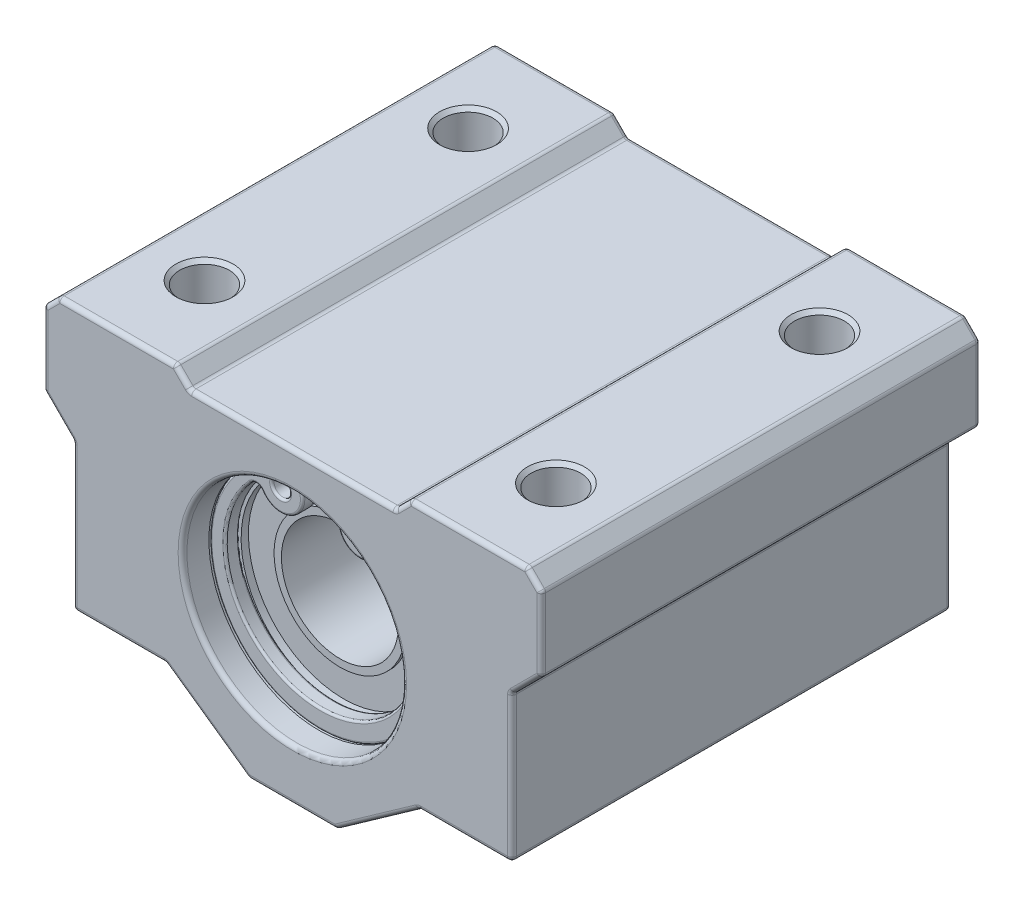
from build123d import *

# Parameters (mm, degrees)
SCHIZZO1_R                    = 7.5
ESTRUSIONE_ESTRUSIONE1_DEPTH  = 15
FORO_PER_VITE_M4_1_D          = 3.4
RIPETIZIONE_A_L1_COUNT        = 2
RIPETIZIONE_A_L1_PITCH        = 24
RIPETIZIONE_A_L1_COUNT_DIR2   = 2
RIPETIZIONE_A_L1_PITCH_DIR2   = 18
SMUSSO1_SIZE                  = 0.25
SMUSSO2_SIZE                  = 0.5
RACCORDO1_R                   = 0.3
TAGLIO_ESTRUSIONE2_DEPTH      = 26.199206396
TAGLIO_ESTRUSIONE2_DEPTH_BACK = 26.199206396
SCHIZZO8_R                    = 4
TAGLIO_ESTRUSIONE1_START      = 12.1
SCHIZZO7_R                    = 7.85
TAGLIO_ESTRUSIONE1_DEPTH      = 1.1
ESTRUSIONE_ESTRUSIONE2_START  = 12.1
SCHIZZO9_R                    = 0.6
ESTRUSIONE_ESTRUSIONE2_DEPTH  = 1
RIPETIZIONE_A_L2_COUNT        = 2
RIPETIZIONE_A_L2_PITCH        = 25.2
RACCORDO4_R                   = 0.15
RACCORDO5_R                   = 0.15


with BuildPart() as part:
    # Schizzo1 → Estrusione-Estrusione1 (new, symmetric)
    with BuildSketch(Plane.XY):
        Polygon((3, -11), (8.666666667, -7), (15, -7), (15, 3), (17, 5), (17, 10), (16, 11), (8, 11), (7, 10), (-7, 10), (-8, 11), (-16, 11), (-17, 10), (-17, 5), (-15, 3), (-15, -7), (-8.666666667, -7), (-3, -11), align=None)
        Circle(SCHIZZO1_R, mode=Mode.SUBTRACT)
    extrude(amount=ESTRUSIONE_ESTRUSIONE1_DEPTH, both=True)

    # Foro per Vite M4-1 (through all)
    with Locations(Plane(origin=(0, 11, 0), x_dir=(1, 0, 0), z_dir=(0, 1, 0))):
        with Locations((-12, 9)):
            foro_per_vite_m4_1 = Hole(FORO_PER_VITE_M4_1_D / 2)

    # Ripetizione a L1: Foro per Vite M4-1 2 × 2
    with Locations(*[(i * RIPETIZIONE_A_L1_PITCH, 0, j * RIPETIZIONE_A_L1_PITCH_DIR2) for i in range(RIPETIZIONE_A_L1_COUNT) for j in range(RIPETIZIONE_A_L1_COUNT_DIR2) if (i, j) != (0, 0)]):
        add(foro_per_vite_m4_1, mode=Mode.SUBTRACT)

    # Smusso1
    smusso1_edges = [part.edges().sort_by_distance(p)[0] for p in [
        (-10.3, 11, -9),
        (-10.3, 11, 9),
        (13.7, 11, -9),
        (13.7, 11, 9),
    ]]
    chamfer(smusso1_edges, length=SMUSSO1_SIZE)

    # Smusso2
    smusso2_edges = [part.edges().sort_by_distance(p)[0] for p in [
        (-10.3, -7, -9),
        (-10.3, -7, 9),
        (13.7, -7, -9),
        (13.7, -7, 9),
    ]]
    chamfer(smusso2_edges, length=SMUSSO2_SIZE)

    # Schizzo6 → Rivoluzione1 (revolve)
    with BuildSketch(Plane(origin=(0, 0, 0), x_dir=(0, 0, -1), z_dir=(1, 0, 0)), mode=Mode.PRIVATE) as rivoluzione1_sk:
        Polygon((-12, 6.5), (-11.5, 6.5), (-11.5, 4.5), (-11.75, 4.5), (-11.75, 0), (11.75, 0), (11.75, 4.5), (11.5, 4.5), (11.5, 6.5), (12, 6.5), (12, 7.5), (-12, 7.5), align=None)
    revolve(rivoluzione1_sk.sketch.rotate(Axis((0, 0, 20), (0, 0, -1)), 180), axis=Axis((0, 0, 20), (0, 0, -1)))

    # Raccordo1
    raccordo1_edges = [part.edges().sort_by_distance(p)[0] for p in [
        (11.833333333, -7, 15),
        (15, -2, 15),
        (-5.833333333, -9, -15),
        (16, 4, 15),
        (-11.833333333, -7, -15),
        (-15, -2, -15),
        (-16, 4, -15),
        (-17, 7.5, -15),
        (-16.5, 10.5, -15),
        (-12, 11, -15),
        (-7.5, 10.5, -15),
        (0, 10, -15),
        (17, 7.5, 15),
        (7.5, 10.5, -15),
        (12, 11, -15),
        (16.5, 10.5, -15),
        (17, 7.5, -15),
        (16, 4, -15),
        (15, -2, -15),
        (11.833333333, -7, -15),
        (16.5, 10.5, 15),
        (5.833333333, -9, -15),
        (0, -11, -15),
        (12, 11, 15),
        (7.5, 10.5, 15),
        (-3, -11, 0),
        (-8.666666667, -7, 0),
        (-15, -7, 0),
        (-15, 3, 0),
        (-17, 5, 0),
        (-17, 10, 0),
        (-16, 11, 0),
        (-8, 11, 0),
        (-7, 10, 0),
        (7, 10, 0),
        (8, 11, 0),
        (16, 11, 0),
        (17, 10, 0),
        (17, 5, 0),
        (15, 3, 0),
        (15, -7, 0),
        (8.666666667, -7, 0),
        (3, -11, 0),
        (0, 10, 15),
        (-7.5, 10.5, 15),
        (-12, 11, 15),
        (0, -11, 15),
        (-16.5, 10.5, 15),
        (-7.5, 0, -15),
        (-17, 7.5, 15),
        (-7.5, 0, 15),
        (-16, 4, 15),
        (-15, -2, 15),
        (-11.833333333, -7, 15),
        (-5.833333333, -9, 15),
        (5.833333333, -9, 15),
    ]]
    fillet(raccordo1_edges, radius=RACCORDO1_R)

    # Schizzo8 → Taglio-Estrusione2 (cut, two sides: drawn at the far end of the back side and taken through both)
    with BuildSketch(Plane.XY.offset(-TAGLIO_ESTRUSIONE2_DEPTH_BACK)):
        with Locations(Location((0, 0, 0), (0, 0, 90))):
            Circle(SCHIZZO8_R)
    extrude(amount=TAGLIO_ESTRUSIONE2_DEPTH + TAGLIO_ESTRUSIONE2_DEPTH_BACK, mode=Mode.SUBTRACT)

    # Schizzo7 → Taglio-Estrusione1 (cut)
    with BuildSketch(Plane.XY.offset(TAGLIO_ESTRUSIONE1_START)):
        Circle(SCHIZZO7_R)
    taglio_estrusione1 = extrude(amount=TAGLIO_ESTRUSIONE1_DEPTH, mode=Mode.SUBTRACT)

    # Specchia1: Taglio-Estrusione1 across plane
    add(taglio_estrusione1.mirror(Plane.XY), mode=Mode.SUBTRACT)


with BuildPart() as body_2:
    # Schizzo9 → Estrusione-Estrusione2 (new body)
    with BuildSketch(Plane.XY.offset(ESTRUSIONE_ESTRUSIONE2_START)):
        with BuildLine():
            ThreePointArc((-3.368793489, 6.75675443), (0, -7.55), (3.368793489, 6.75675443))
            ThreePointArc((3.368793489, 6.75675443), (1.254348915, 5.012422945), (3.965778539, 4.610281696))
            ThreePointArc((3.965778539, 4.610281696), (4.341737039, 4.840124939), (4.7535285, 4.683279463))
            ThreePointArc((4.7535285, 4.683279463), (0, -6.25), (-4.7535285, 4.683279463))
            ThreePointArc((-4.7535285, 4.683279463), (-4.341737039, 4.840124939), (-3.965778539, 4.610281696))
            ThreePointArc((-3.965778539, 4.610281696), (-1.254348915, 5.012422945), (-3.368793489, 6.75675443))
        make_face()
        with Locations((-2.699496769, 5.414352888)):
            Circle(SCHIZZO9_R, mode=Mode.SUBTRACT)
        with Locations((2.699496769, 5.414352888)):
            Circle(SCHIZZO9_R, mode=Mode.SUBTRACT)
    estrusione_estrusione2 = extrude(amount=ESTRUSIONE_ESTRUSIONE2_DEPTH)

    # Raccordo4
    raccordo4_edges = [body_2.edges().sort_by_distance(p)[0] for p in [
        (0, -6.25, 13.1),
        (-4.341737039, 4.840124939, 13.1),
        (-1.254348915, 5.012422945, 13.1),
        (-3.299496769, 5.414352888, 12.1),
        (-3.299496769, 5.414352888, 13.1),
        (0, -7.55, 13.1),
        (2.099496769, 5.414352888, 12.1),
        (2.099496769, 5.414352888, 13.1),
        (1.254348915, 5.012422945, 13.1),
        (0, -7.55, 12.1),
        (-1.254348915, 5.012422945, 12.1),
        (-4.341737039, 4.840124939, 12.1),
        (4.341737039, 4.840124939, 13.1),
        (0, -6.25, 12.1),
        (4.341737039, 4.840124939, 12.1),
        (1.254348915, 5.012422945, 12.1),
    ]]
    fillet(raccordo4_edges, radius=RACCORDO4_R)


with BuildPart() as ripetizione_a_l2_1:
    # Ripetizione a L2: Estrusione-Estrusione2 ×2
    with Locations(*[(0, 0, -i * RIPETIZIONE_A_L2_PITCH) for i in range(1, RIPETIZIONE_A_L2_COUNT)]):
        add(estrusione_estrusione2)

    # Raccordo5
    raccordo5_edges = [ripetizione_a_l2_1.edges().sort_by_distance(p)[0] for p in [
        (0, -6.25, -12.1),
        (-4.341737039, 4.840124939, -12.1),
        (-1.254348915, 5.012422945, -12.1),
        (-3.299496769, 5.414352888, -13.1),
        (-3.299496769, 5.414352888, -12.1),
        (0, -7.55, -12.1),
        (2.099496769, 5.414352888, -13.1),
        (2.099496769, 5.414352888, -12.1),
        (1.254348915, 5.012422945, -12.1),
        (0, -7.55, -13.1),
        (-1.254348915, 5.012422945, -13.1),
        (-4.341737039, 4.840124939, -13.1),
        (4.341737039, 4.840124939, -12.1),
        (0, -6.25, -13.1),
        (4.341737039, 4.840124939, -13.1),
        (1.254348915, 5.012422945, -13.1),
    ]]
    fillet(raccordo5_edges, radius=RACCORDO5_R)


solid = Compound([part.part, body_2.part, ripetizione_a_l2_1.part])
